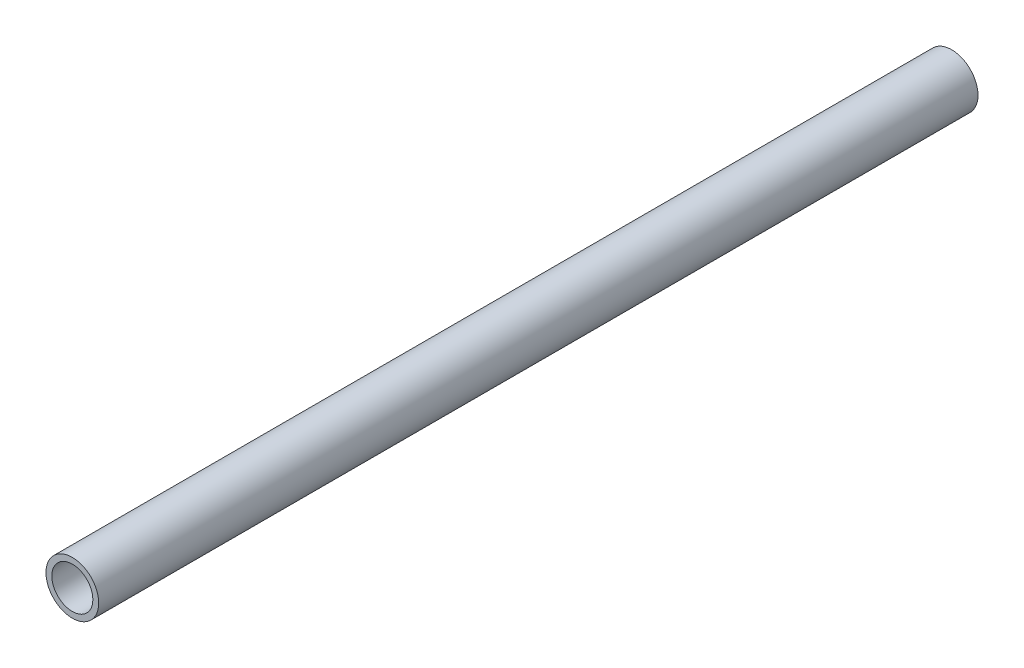
from build123d import *

# Parameters (mm, degrees)
SKETCH_1_R      = 9
SKETCH_1_R_2    = 7
EXTRUDE_1_DEPTH = 300.06


with BuildPart() as part:
    # 草图1 → 凸台-拉伸1 (new body)
    with BuildSketch(Plane.XY):
        Circle(SKETCH_1_R)
        Circle(SKETCH_1_R_2, mode=Mode.SUBTRACT)
    extrude(amount=EXTRUDE_1_DEPTH)


solid = part.part
